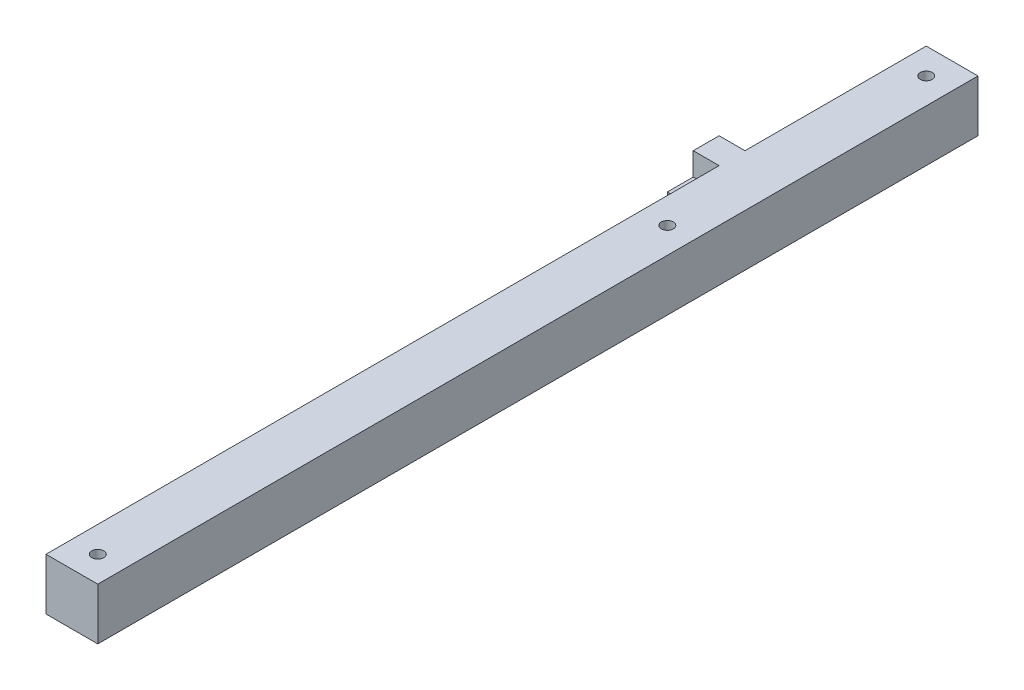
from build123d import *

# Parameters (mm, degrees)
SKETCH18_W                  = 12.7
SKETCH18_H                  = 215.9
BOSS_EXTRUDE3_DEPTH         = 12.7
F_32_0_116_DIAMETER_HOLE7_D = 2.9464
SKETCH29_W                  = 6.35
SKETCH29_H                  = 12.7
BOSS_EXTRUDE4_DEPTH         = 6.35
SKETCH30_W                  = 6.35
SKETCH30_H                  = 7.112
BOSS_EXTRUDE5_DEPTH         = 6.35


with BuildPart() as part:
    # Sketch18 → Boss-Extrude3 (new body)
    with BuildSketch(Plane(origin=(0, 0, 0), x_dir=(1, 0, 0), z_dir=(0, 1, 0))):
        with Locations((-6.35, 95.25)):
            Rectangle(SKETCH18_W, SKETCH18_H)
    extrude(amount=BOSS_EXTRUDE3_DEPTH)

    # #32 (0.116) Diameter Hole7 (through all)
    with Locations(Plane(origin=(0, 12.7, 0), x_dir=(1, 0, 0), z_dir=(0, 1, 0))):
        with Locations((-6.35, 196.85), (-6.35, 133.35), (-6.35, -6.35)):
            Hole(F_32_0_116_DIAMETER_HOLE7_D / 2)

    # Sketch29 → Boss-Extrude4 (add)
    with BuildSketch(Plane.ZY.offset(12.7)):
        with Locations((-155.575, 6.35)):
            Rectangle(SKETCH29_W, SKETCH29_H)
    extrude(amount=BOSS_EXTRUDE4_DEPTH)

    # Sketch30 → Boss-Extrude5 (add)
    with BuildSketch(Plane.ZY.offset(12.7)):
        with Locations((-149.225, 3.556)):
            Rectangle(SKETCH30_W, SKETCH30_H)
    extrude(amount=BOSS_EXTRUDE5_DEPTH)


solid = part.part
